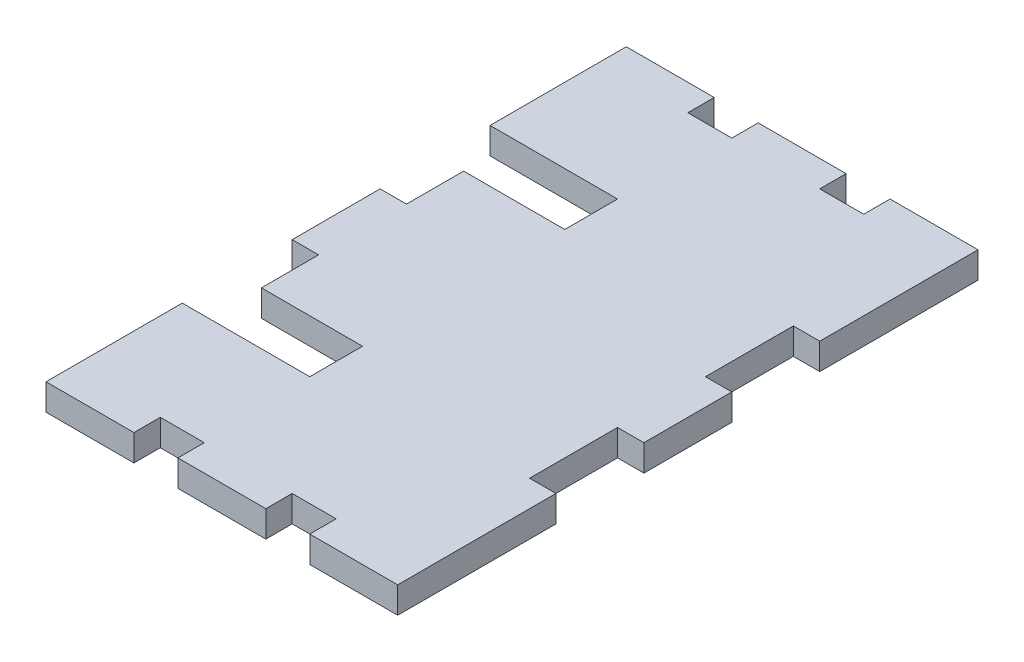
from build123d import *

# Parameters (mm, degrees)
RESSALTO_EXTRUS_O9_DEPTH = 6


with BuildPart() as part:
    # Esboço1 → Ressalto-extrusão9 (new body)
    with BuildSketch(Plane(origin=(0, 0, 0), x_dir=(1, 0, 0), z_dir=(0, 1, 0))):
        Polygon((-40, -6), (-40, 0), (-60, 0), (-60, -30.999999612), (-31, -30.999999612), (-31, -42.999999612), (-31, -65.999999612), (-31, -88.999999612), (-31, -100.999999612), (-60, -100.999999612), (-60, -131.999999612), (-40, -131.999999612), (-40, -125.999999612), (-30, -125.999999612), (-30, -131.999999612), (-10, -131.999999612), (-10, -125.999999612), (0, -125.999999612), (0, -131.999999612), (20, -131.999999612), (20, -95.999999612), (14, -95.999999612), (14, -75.999999612), (20, -75.999999612), (20, -55.999999612), (14, -55.999999612), (14, -36), (20, -36), (20, 0), (0, 0), (0, -6), (-10, -6), (-10, 0), (-30, 0), (-30, -6), align=None)
        Polygon((-31, -65.999999612), (-31, -42.999999612), (-54, -42.999999612), (-54, -55.999999612), (-60, -55.999999612), (-60, -65.999999612), align=None)
        Polygon((-31, -88.999999612), (-31, -65.999999612), (-60, -65.999999612), (-60, -75.999999612), (-54, -75.999999612), (-54, -88.999999612), align=None)
    extrude(amount=RESSALTO_EXTRUS_O9_DEPTH)


solid = part.part
